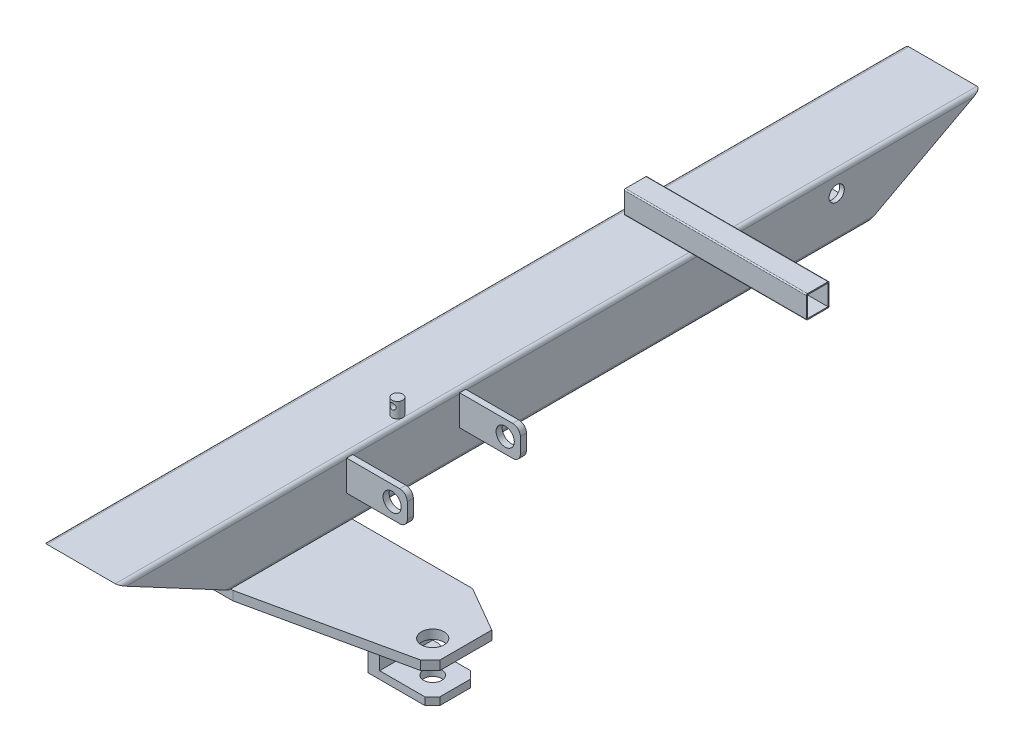
from build123d import *
from OCP.BRepFilletAPI import BRepFilletAPI_MakeChamfer

# Parameters (mm, degrees)
SCHIZZO1_W                      = 88
SCHIZZO1_H                      = 68
ESTRUSIONE_SOTTILE1_DEPTH       = 1200
ESTRUSIONE1_DEPTH               = 1207.813987324
SCHIZZO4_R                      = 15
ESTRUSIONE3_DEPTH               = 12
SCHIZZO5_W                      = 15
SCHIZZO5_H                      = 70
ESTRUSIONE4_DEPTH               = 30
ESTRUSIONE5_DEPTH               = 10
SCHIZZO8_R                      = 12
ESTRUSIONE6_DEPTH               = 1244.48542412
SMUSSO1_SIZE                    = 60
SMUSSO1_SIZE2                   = 34.641016151
SMUSSO2_SIZE                    = 10
SMUSSO2_SIZE2                   = 13.08013562
RACCORDO1_R                     = 8
SCHIZZO9_R                      = 6
ESTRUSIONE7_DEPTH               = 1222.90670675
SCHIZZO10_R                     = 10
ESTRUSIONE8_DEPTH               = 10
ESTRUSIONE_SOTTILE2_DEPTH       = 150
ESTRUSIONE_SOTTILE2_DEPTH_BACK  = 90
SCHIZZO11_W                     = 27
SCHIZZO11_H                     = 27
SCHIZZO12_W                     = 8
SCHIZZO12_H                     = 40
ESTRUSIONE_ESTRUSIONE1_DEPTH    = 80
SCHIZZO13_R                     = 12
TAGLIO_ESTRUSIONE1_DEPTH        = 894.050950394
RACCORDO2_R                     = 10
RIPETIZIONE_A_L1_COUNT          = 2
RIPETIZIONE_A_L1_PITCH          = 149
RACCORDO2_OF_RIPETIZIONE_A_L1_R = 10
SCHIZZO14_R                     = 7
ESTRUSIONE_ESTRUSIONE2_DEPTH    = 20
TAGLIO_ESTRUSIONE2_START        = 670
SCHIZZO15_R                     = 4
TAGLIO_ESTRUSIONE2_DEPTH        = 250


with BuildPart() as part:
    # Schizzo1 → Estrusione-Sottile1 (new body)
    with BuildSketch(Plane.XY):
        with BuildLine():
            Line((5, 0), (95, 0))
            ThreePointArc((95, 0), (98.535533906, 1.464466094), (100, 5))
            Line((100, 5), (100, 75))
            ThreePointArc((100, 75), (98.535533906, 78.535533906), (95, 80))
            Line((95, 80), (5, 80))
            ThreePointArc((5, 80), (1.464466094, 78.535533906), (0, 75))
            Line((0, 75), (0, 5))
            ThreePointArc((0, 5), (1.464466094, 1.464466094), (5, 0))
        make_face()
        with Locations((50, 40)):
            Rectangle(SCHIZZO1_W, SCHIZZO1_H, mode=Mode.SUBTRACT)
    extrude(amount=ESTRUSIONE_SOTTILE1_DEPTH)

    # Schizzo2 → Estrusione1 (cut, through all)
    with BuildSketch(Plane(origin=(100, 0, 0), x_dir=(0, 0, -1), z_dir=(1, 0, 0))):
        Polygon((-1200, 80), (-1050, 0), (-1200, 0), align=None)
        Polygon((-64, 80), (-214, 0), (0, 0), (0, 80), align=None)
    extrude(amount=-ESTRUSIONE1_DEPTH, mode=Mode.SUBTRACT)

    # Schizzo4 → Estrusione3 (add)
    with BuildSketch(Plane.XZ):
        Polygon((5, 1050), (100, 1050), (316, 1003), (316, 890), (95, 890), (5, 890), align=None)
        with Locations(Location((286.5, 973, 0), (0, 0, 270))):
            Circle(SCHIZZO4_R, mode=Mode.SUBTRACT)
    extrude(amount=ESTRUSIONE3_DEPTH)

    # Schizzo5 → Estrusione4 (add)
    with BuildSketch(Plane.XZ.offset(12)):
        with Locations((239, 968)):
            Rectangle(SCHIZZO5_W, SCHIZZO5_H)
    extrude(amount=ESTRUSIONE4_DEPTH)

    # Schizzo7 → Estrusione5 (add)
    with BuildSketch(Plane.XZ.offset(42)):
        Polygon((231.5, 1003), (316, 1003), (316, 943), (261.5, 943), (261.5, 933), (231.5, 933), align=None)
    extrude(amount=ESTRUSIONE5_DEPTH)

    # Schizzo8 → Estrusione6 (cut, through all)
    with BuildSketch(Plane(origin=(0, 0, 0), x_dir=(1, 0, 0), z_dir=(0, 1, 0))):
        with Locations(Location((286.5, -973, 0), (0, 0, 270))):
            Circle(SCHIZZO8_R)
    extrude(amount=-ESTRUSIONE6_DEPTH, mode=Mode.SUBTRACT)

    # Smusso1
    smusso1_edges = [part.edges().sort_by_distance(p)[0] for p in [
        (316, -6, 890),
    ]]
    smusso1_side = [part.faces().sort_by_distance(p)[0] for p in [
        (160.5, -6, 890),
    ]]
    chamfer(smusso1_edges, length=SMUSSO1_SIZE, length2=SMUSSO1_SIZE2, reference=smusso1_side[0])

    # Smusso2: one chamfer whose edges measure the first distance from different faces: ONE call of the kernel's chamfer builder (chamfer() names one face for all edges)
    smusso2_edges_1 = [part.edges().sort_by_distance(p)[0] for p in [
        (316, -6, 1003),
    ]]
    smusso2_side_1 = [part.faces().sort_by_distance(p)[0] for p in [
        (316, -6, 963.820508076),
    ]]
    smusso2_edges_2 = [part.edges().sort_by_distance(p)[0] for p in [
        (316, -47, 1003),
        (316, -47, 943),
    ]]
    smusso2 = BRepFilletAPI_MakeChamfer(part.part.solid().wrapped)
    for e in smusso2_edges_1:
        smusso2.Add(SMUSSO2_SIZE, SMUSSO2_SIZE2, e.wrapped, smusso2_side_1[0].wrapped)  # the first distance lies on this face
    for e in smusso2_edges_2:
        smusso2.Add(SMUSSO2_SIZE, e.wrapped)
    add(Compound.cast(smusso2.Shape()), mode=Mode.REPLACE)

    # Raccordo1
    raccordo1_edges = [part.edges().sort_by_distance(p)[0] for p in [
        (261.5, -47, 933),
    ]]
    fillet(raccordo1_edges, radius=RACCORDO1_R)

    # Schizzo9 → Estrusione7 (cut, through all)
    with BuildSketch(Plane(origin=(100, 0, 0), x_dir=(0, 0, -1), z_dir=(1, 0, 0))):
        with Locations((-254, 55)):
            Circle(SCHIZZO9_R)
    extrude(amount=-ESTRUSIONE7_DEPTH, mode=Mode.SUBTRACT)

    # Schizzo10 → Estrusione8 (cut)
    with BuildSketch(Plane(origin=(100, 0, 0), x_dir=(0, 0, -1), z_dir=(1, 0, 0))):
        with Locations((-254, 55)):
            Circle(SCHIZZO10_R)
    extrude(amount=-ESTRUSIONE8_DEPTH, mode=Mode.SUBTRACT)

    # Schizzo11 → Estrusione-Sottile2 (add, two sides: drawn at the far end of the back side and taken through both)
    with BuildSketch(Plane(origin=(100, 0, 0), x_dir=(0, 0, -1), z_dir=(1, 0, 0)).offset(-ESTRUSIONE_SOTTILE2_DEPTH_BACK)):
        with BuildLine():
            Line((-442.5, 110), (-415.5, 110))
            ThreePointArc((-415.5, 110), (-414.439339828, 109.560660172), (-414, 108.5))
            Line((-414, 108.5), (-414, 81.5))
            ThreePointArc((-414, 81.5), (-414.439339828, 80.439339828), (-415.5, 80))
            Line((-415.5, 80), (-442.5, 80))
            ThreePointArc((-442.5, 80), (-443.560660172, 80.439339828), (-444, 81.5))
            Line((-444, 81.5), (-444, 108.5))
            ThreePointArc((-444, 108.5), (-443.560660172, 109.560660172), (-442.5, 110))
        make_face()
        with Locations((-429, 95)):
            Rectangle(SCHIZZO11_W, SCHIZZO11_H, mode=Mode.SUBTRACT)
    extrude(amount=ESTRUSIONE_SOTTILE2_DEPTH + ESTRUSIONE_SOTTILE2_DEPTH_BACK)

    # Schizzo12 → Estrusione-Estrusione1 (add)
    with BuildSketch(Plane(origin=(100, 0, 0), x_dir=(0, 0, -1), z_dir=(1, 0, 0))):
        with Locations((-896, 56)):
            Rectangle(SCHIZZO12_W, SCHIZZO12_H)
    estrusione_estrusione1 = extrude(amount=ESTRUSIONE_ESTRUSIONE1_DEPTH)

    # Schizzo13 → Taglio-Estrusione1 (cut, through all)
    with BuildSketch(Plane(origin=(0, 0, 892), x_dir=(-1, 0, 0), z_dir=(0, 0, -1))):
        with Locations((-160, 56)):
            Circle(SCHIZZO13_R)
    taglio_estrusione1 = extrude(amount=-TAGLIO_ESTRUSIONE1_DEPTH, mode=Mode.SUBTRACT)

    # Raccordo2
    raccordo2_edges = [part.edges().sort_by_distance(p)[0] for p in [
        (180, 36, 896),
        (180, 76, 896),
    ]]
    fillet(raccordo2_edges, radius=RACCORDO2_R)

    # Ripetizione a L1: Estrusione-Estrusione1, Taglio-Estrusione1 ×2
    with Locations(*[(0, 0, -i * RIPETIZIONE_A_L1_PITCH) for i in range(1, RIPETIZIONE_A_L1_COUNT)]):
        add(estrusione_estrusione1)
        add(taglio_estrusione1, mode=Mode.SUBTRACT)

    # Raccordo2 of Ripetizione a L1
    raccordo2_of_ripetizione_a_l1_edges = [part.edges().sort_by_distance(p)[0] for p in [
        (180, 36, 747),
        (180, 76, 747),
    ]]
    fillet(raccordo2_of_ripetizione_a_l1_edges, radius=RACCORDO2_OF_RIPETIZIONE_A_L1_R)

    # Schizzo14 → Estrusione-Estrusione2 (add)
    with BuildSketch(Plane(origin=(0, 80, 0), x_dir=(1, 0, 0), z_dir=(0, 1, 0))):
        with Locations((88, -821)):
            Circle(SCHIZZO14_R)
    extrude(amount=ESTRUSIONE_ESTRUSIONE2_DEPTH)

    # Schizzo15 → Taglio-Estrusione2 (cut)
    with BuildSketch(Plane.XY.offset(TAGLIO_ESTRUSIONE2_START)):
        with Locations(Location((88, 93, 0), (0, 0, 180))):
            Circle(SCHIZZO15_R)
    extrude(amount=TAGLIO_ESTRUSIONE2_DEPTH, mode=Mode.SUBTRACT)


solid = part.part
